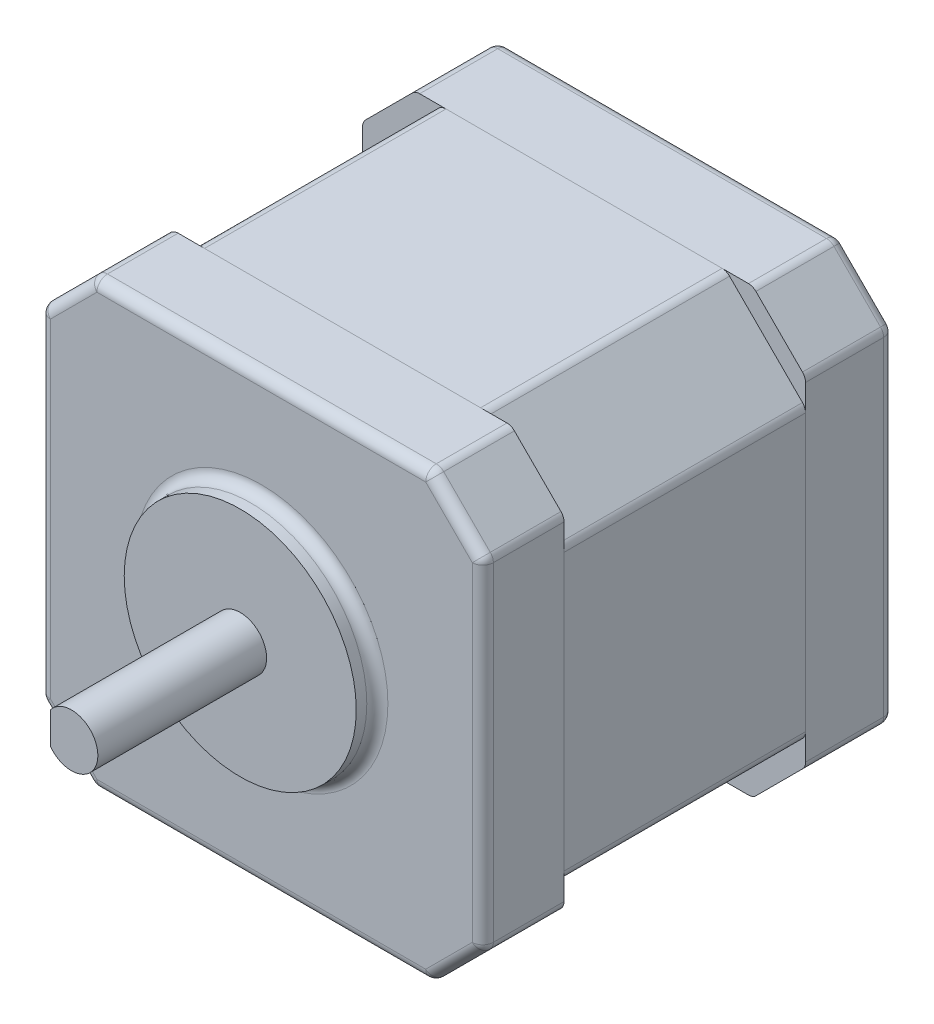
from build123d import *

# Parameters (mm, degrees)
SKETCH1_W           = 42
SKETCH1_H           = 42
BOSS_EXTRUDE1_DEPTH = 19.5
CUT_EXTRUDE1_START  = -7.7
CUT_EXTRUDE1_DEPTH  = 22.9
SKETCH3_R           = 11
BOSS_EXTRUDE2_DEPTH = 2
CHAMFER1_SIZE       = 5
FILLET1_R           = 1
BOSS_EXTRUDE3_DEPTH = 16


with BuildPart() as part:
    # Sketch1 → Boss-Extrude1 (new, symmetric)
    with BuildSketch(Plane.XY):
        Rectangle(SKETCH1_W, SKETCH1_H)
    extrude(amount=BOSS_EXTRUDE1_DEPTH, both=True)

    # Sketch2 → Cut-Extrude1 (cut)
    with BuildSketch(Plane.XY.offset(19.5).offset(CUT_EXTRUDE1_START)):
        Polygon((-21, 21), (-13.5, 21), (-21, 13.5), align=None)
        Polygon((13.5, 21), (21, 21), (21, 13.5), align=None)
        Polygon((21, -13.5), (21, -21), (13.5, -21), align=None)
        Polygon((-13.5, -21), (-21, -21), (-21, -13.5), align=None)
    extrude(amount=-CUT_EXTRUDE1_DEPTH, mode=Mode.SUBTRACT)

    # Sketch3 → Boss-Extrude2 (add)
    with BuildSketch(Plane.XY.offset(19.5)):
        Circle(SKETCH3_R)
    extrude(amount=BOSS_EXTRUDE2_DEPTH)

    # Chamfer1
    chamfer1_edges = [part.edges().sort_by_distance(p)[0] for p in [
        (21, -21, -15.3),
        (-21, -21, -15.3),
        (-21, 21, -15.3),
        (21, 21, -15.3),
        (21, -21, 15.65),
        (-21, -21, 15.65),
        (-21, 21, 15.65),
        (21, 21, 15.65),
    ]]
    chamfer(chamfer1_edges, length=CHAMFER1_SIZE)

    # Fillet1
    fillet1_edges = [part.edges().sort_by_distance(p)[0] for p in [
        (-21, -13.5, 0.35),
        (-13.5, -21, 0.35),
        (13.5, -21, 0.35),
        (21, -13.5, 0.35),
        (21, 13.5, 0.35),
        (13.5, 21, 0.35),
        (-21, 13.5, 0.35),
        (-13.5, 21, 0.35),
        (-11, 0, 19.5),
        (0, 21, -19.5),
        (0, 21, 19.5),
        (-16, 21, 15.65),
        (-16, 21, -15.3),
        (16, 21, 15.65),
        (16, 21, -15.3),
        (21, 0, -19.5),
        (0, -21, -19.5),
        (-21, 0, -19.5),
        (-18.5, -18.5, -19.5),
        (-18.5, 18.5, -19.5),
        (18.5, -18.5, -19.5),
        (18.5, 18.5, -19.5),
        (21, 0, 19.5),
        (21, -16, -15.3),
        (21, -16, 15.65),
        (21, 16, 15.65),
        (21, 16, -15.3),
        (-21, 0, 19.5),
        (0, -21, 19.5),
        (-18.5, 18.5, 19.5),
        (-18.5, -18.5, 19.5),
        (18.5, -18.5, 19.5),
        (18.5, 18.5, 19.5),
        (-16, -21, 15.65),
        (-16, -21, -15.3),
        (16, -21, -15.3),
        (16, -21, 15.65),
        (-21, 16, 15.65),
        (-21, -16, 15.65),
        (-21, -16, -15.3),
        (-21, 16, -15.3),
    ]]
    fillet(fillet1_edges, radius=FILLET1_R)

    # Sketch4 → Boss-Extrude3 (add)
    with BuildSketch(Plane.XY.offset(21.5)):
        with BuildLine():
            Line((-2, -1.5), (-2, 1.5))
            ThreePointArc((-2, 1.5), (2.5, 0), (-2, -1.5))
        make_face()
    extrude(amount=BOSS_EXTRUDE3_DEPTH)


solid = part.part
